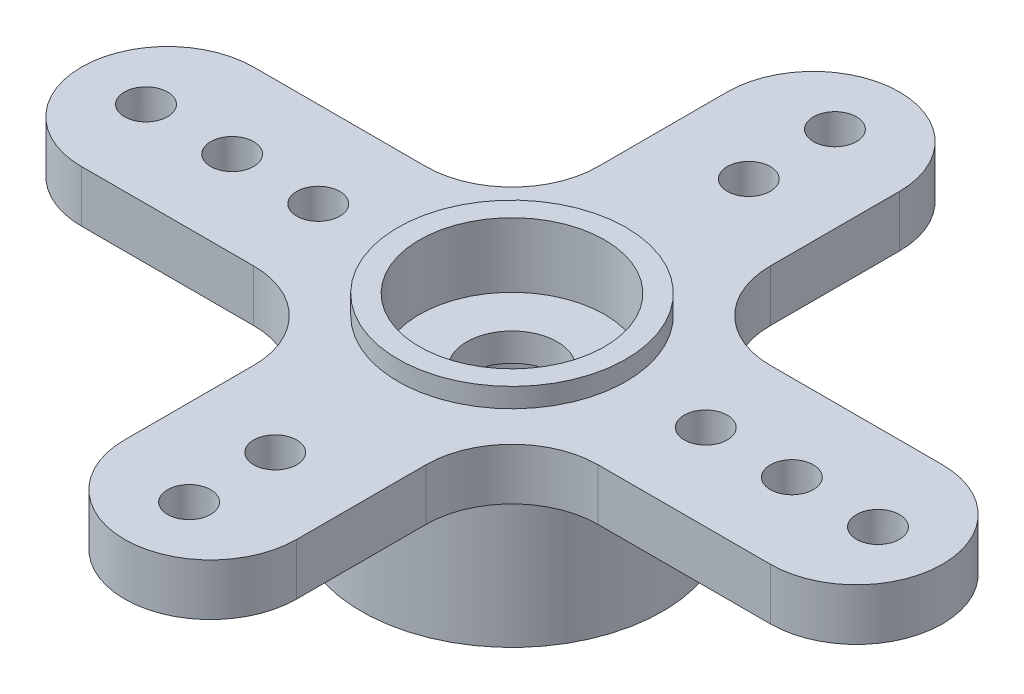
from build123d import *

# Parameters (mm, degrees)
F_1_0_1_DIAMETER_HOLE1_AT_2_COUNT = 2
F_1_0_1_DIAMETER_HOLE1_AT_2_PITCH = 4
F_1_0_1_DIAMETER_HOLE1_AT_3_COUNT = 2
F_1_0_1_DIAMETER_HOLE1_AT_3_PITCH = 2
F_1_0_1_DIAMETER_HOLE1_AT_4_COUNT = 2
F_1_0_1_DIAMETER_HOLE1_AT_4_PITCH = 4
F_1_0_1_DIAMETER_HOLE1_AT_5_COUNT = 2
F_1_0_1_DIAMETER_HOLE1_AT_5_PITCH = 6.5
CIRPATTERN1_COUNT                 = 2
F_1_0_1_DIAMETER_HOLE2_AT_2_COUNT = 2
F_1_0_1_DIAMETER_HOLE2_AT_2_PITCH = 2
F_1_0_1_DIAMETER_HOLE2_AT_3_COUNT = 2
F_1_0_1_DIAMETER_HOLE2_AT_3_PITCH = 5.5
CIRPATTERN2_COUNT                 = 2
CUT_EXTRUDE5_DEPTH                = 36.603932367
CUT_EXTRUDE5_DEPTH_BACK           = 36.603932367
SKETCH9_OUTSIDE_W                 = 66.172
SKETCH9_OUTSIDE_H                 = 66.172


with BuildPart() as part:
    # Sketch1 → Revolve1 (revolve)
    with BuildSketch(Plane.XY, mode=Mode.PRIVATE) as revolve1_sk:
        Polygon((1.05, 0), (2.25, 0), (2.25, -2.5), (3.5, -2.5), (3.5, 0.5), (25, 0.5), (25, 1.7), (2.65, 1.7), (2.65, 2.15), (2.15, 2.15), (2.15, 0.65), (1.05, 0.65), align=None)
    revolve(revolve1_sk.sketch.rotate(Axis((0, -19.458040139, 0), (0, 1, 0)), 90), axis=Axis((0, -19.458040139, 0), (0, 1, 0)))

    # Sketch2 → Ø1.0 (1) Diameter Hole1 (revolve, cut)
    with BuildSketch(Plane(origin=(-8.5, 1.7, 0), x_dir=(0, 0, 1), z_dir=(1, 0, 0))):
        Polygon((0, 0), (0, 387.73043031), (0.5, 387.43), (0.5, 0), align=None)
    f_1_0_1_diameter_hole1 = revolve(axis=Axis((-8.5, 8.05, 0), (0, -1, 0)), mode=Mode.SUBTRACT)

    # Ø1.0 (1) Diameter Hole1 at 2: Ø1.0 (1) Diameter Hole1 ×2
    with Locations(*[(i * F_1_0_1_DIAMETER_HOLE1_AT_2_PITCH, 0, 0) for i in range(1, F_1_0_1_DIAMETER_HOLE1_AT_2_COUNT)]):
        add(f_1_0_1_diameter_hole1, mode=Mode.SUBTRACT)

    # Ø1.0 (1) Diameter Hole1 at 3: Ø1.0 (1) Diameter Hole1 ×2
    with Locations(*[(i * F_1_0_1_DIAMETER_HOLE1_AT_3_PITCH, 0, 0) for i in range(1, F_1_0_1_DIAMETER_HOLE1_AT_3_COUNT)]):
        add(f_1_0_1_diameter_hole1, mode=Mode.SUBTRACT)

    # Ø1.0 (1) Diameter Hole1 at 4: Ø1.0 (1) Diameter Hole1 ×2
    with Locations(*[(-i * F_1_0_1_DIAMETER_HOLE1_AT_4_PITCH, 0, 0) for i in range(1, F_1_0_1_DIAMETER_HOLE1_AT_4_COUNT)]):
        add(f_1_0_1_diameter_hole1, mode=Mode.SUBTRACT)

    # Ø1.0 (1) Diameter Hole1 at 5: Ø1.0 (1) Diameter Hole1 ×2
    with Locations(*[(-i * F_1_0_1_DIAMETER_HOLE1_AT_5_PITCH, 0, 0) for i in range(1, F_1_0_1_DIAMETER_HOLE1_AT_5_COUNT)]):
        add(f_1_0_1_diameter_hole1, mode=Mode.SUBTRACT)

    # CirPattern1: Ø1.0 (1) Diameter Hole1 ×2 about axis
    cirpattern1_axis = Axis((0, 0, 0), (0, 1, 0))
    for i in range(1, CIRPATTERN1_COUNT):
        add(f_1_0_1_diameter_hole1.rotate(cirpattern1_axis, i * 360 / CIRPATTERN1_COUNT), mode=Mode.SUBTRACT)

    # CirPattern1 copy 1 sketch → CirPattern1 copy 1 (revolve, cut)
    with BuildSketch(Plane(origin=(4.5, 1.7, 0), x_dir=(0, 0, -1), z_dir=(-1, 0, 0))):
        Polygon((0, 0), (0, 387.73043031), (0.5, 387.43), (0.5, 0), align=None)
    revolve(axis=Axis((4.5, 8.05, 0), (0, -1, 0)), mode=Mode.SUBTRACT)

    # CirPattern1 copy 2 sketch → CirPattern1 copy 2 (revolve, cut)
    with BuildSketch(Plane(origin=(6.5, 1.7, 0), x_dir=(0, 0, -1), z_dir=(-1, 0, 0))):
        Polygon((0, 0), (0, 387.73043031), (0.5, 387.43), (0.5, 0), align=None)
    revolve(axis=Axis((6.5, 8.05, 0), (0, -1, 0)), mode=Mode.SUBTRACT)

    # CirPattern1 copy 3 sketch → CirPattern1 copy 3 (revolve, cut)
    with BuildSketch(Plane(origin=(12.5, 1.7, 0), x_dir=(0, 0, -1), z_dir=(-1, 0, 0))):
        Polygon((0, 0), (0, 387.73043031), (0.5, 387.43), (0.5, 0), align=None)
    revolve(axis=Axis((12.5, 8.05, 0), (0, -1, 0)), mode=Mode.SUBTRACT)

    # CirPattern1 copy 4 sketch → CirPattern1 copy 4 (revolve, cut)
    with BuildSketch(Plane(origin=(15, 1.7, 0), x_dir=(0, 0, -1), z_dir=(-1, 0, 0))):
        Polygon((0, 0), (0, 387.73043031), (0.5, 387.43), (0.5, 0), align=None)
    revolve(axis=Axis((15, 8.05, 0), (0, -1, 0)), mode=Mode.SUBTRACT)

    # Sketch7 → Ø1.0 (1) Diameter Hole2 (revolve, cut)
    with BuildSketch(Plane(origin=(0, 1.7, -5.5), x_dir=(0, 0, 1), z_dir=(1, 0, 0))):
        Polygon((0, 0), (0, 387.73043031), (0.5, 387.43), (0.5, 0), align=None)
    f_1_0_1_diameter_hole2 = revolve(axis=Axis((0, 8.05, -5.5), (0, -1, 0)), mode=Mode.SUBTRACT)

    # Ø1.0 (1) Diameter Hole2 at 2: Ø1.0 (1) Diameter Hole2 ×2
    with Locations(*[(0, 0, -i * F_1_0_1_DIAMETER_HOLE2_AT_2_PITCH) for i in range(1, F_1_0_1_DIAMETER_HOLE2_AT_2_COUNT)]):
        add(f_1_0_1_diameter_hole2, mode=Mode.SUBTRACT)

    # Ø1.0 (1) Diameter Hole2 at 3: Ø1.0 (1) Diameter Hole2 ×2
    with Locations(*[(0, 0, -i * F_1_0_1_DIAMETER_HOLE2_AT_3_PITCH) for i in range(1, F_1_0_1_DIAMETER_HOLE2_AT_3_COUNT)]):
        add(f_1_0_1_diameter_hole2, mode=Mode.SUBTRACT)

    # CirPattern2: Ø1.0 (1) Diameter Hole2 ×2 about axis
    cirpattern2_axis = Axis((0, 0, 0), (0, 1, 0))
    for i in range(1, CIRPATTERN2_COUNT):
        add(f_1_0_1_diameter_hole2.rotate(cirpattern2_axis, i * 360 / CIRPATTERN2_COUNT), mode=Mode.SUBTRACT)

    # CirPattern2 copy 1 sketch → CirPattern2 copy 1 (revolve, cut)
    with BuildSketch(Plane(origin=(0, 1.7, 7.5), x_dir=(0, 0, -1), z_dir=(-1, 0, 0))):
        Polygon((0, 0), (0, 387.73043031), (0.5, 387.43), (0.5, 0), align=None)
    revolve(axis=Axis((0, 8.05, 7.5), (0, -1, 0)), mode=Mode.SUBTRACT)

    # CirPattern2 copy 2 sketch → CirPattern2 copy 2 (revolve, cut)
    with BuildSketch(Plane(origin=(0, 1.7, 11), x_dir=(0, 0, -1), z_dir=(-1, 0, 0))):
        Polygon((0, 0), (0, 387.73043031), (0.5, 387.43), (0.5, 0), align=None)
    revolve(axis=Axis((0, 8.05, 11), (0, -1, 0)), mode=Mode.SUBTRACT)

    # Sketch9 outside → Cut-Extrude5 (cut, two sides: drawn at the far end of the back side and taken through both)
    with BuildSketch(Plane(origin=(0, 1.7, 0), x_dir=(1, 0, 0), z_dir=(0, 1, 0)).offset(-CUT_EXTRUDE5_DEPTH_BACK)):
        Rectangle(SKETCH9_OUTSIDE_W, SKETCH9_OUTSIDE_H)
        with BuildLine():
            Line((8, 2), (4, 2))
            ThreePointArc((4, 2), (2.585786438, 2.585786438), (2, 4))
            Line((2, 4), (2, 7))
            ThreePointArc((2, 7), (0, 9), (-2, 7))
            Line((-2, 7), (-2, 4))
            ThreePointArc((-2, 4), (-2.585786438, 2.585786438), (-4, 2))
            Line((-4, 2), (-8, 2))
            ThreePointArc((-8, 2), (-10, 0), (-8, -2))
            Line((-8, -2), (-4, -2))
            ThreePointArc((-4, -2), (-2.585786438, -2.585786438), (-2, -4))
            Line((-2, -4), (-2, -7))
            ThreePointArc((-2, -7), (0, -9), (2, -7))
            Line((2, -7), (2, -4))
            ThreePointArc((2, -4), (2.585786438, -2.585786438), (4, -2))
            Line((4, -2), (8, -2))
            ThreePointArc((8, -2), (10, 0), (8, 2))
        make_face(mode=Mode.SUBTRACT)
    extrude(amount=CUT_EXTRUDE5_DEPTH + CUT_EXTRUDE5_DEPTH_BACK, mode=Mode.SUBTRACT)


solid = part.part
